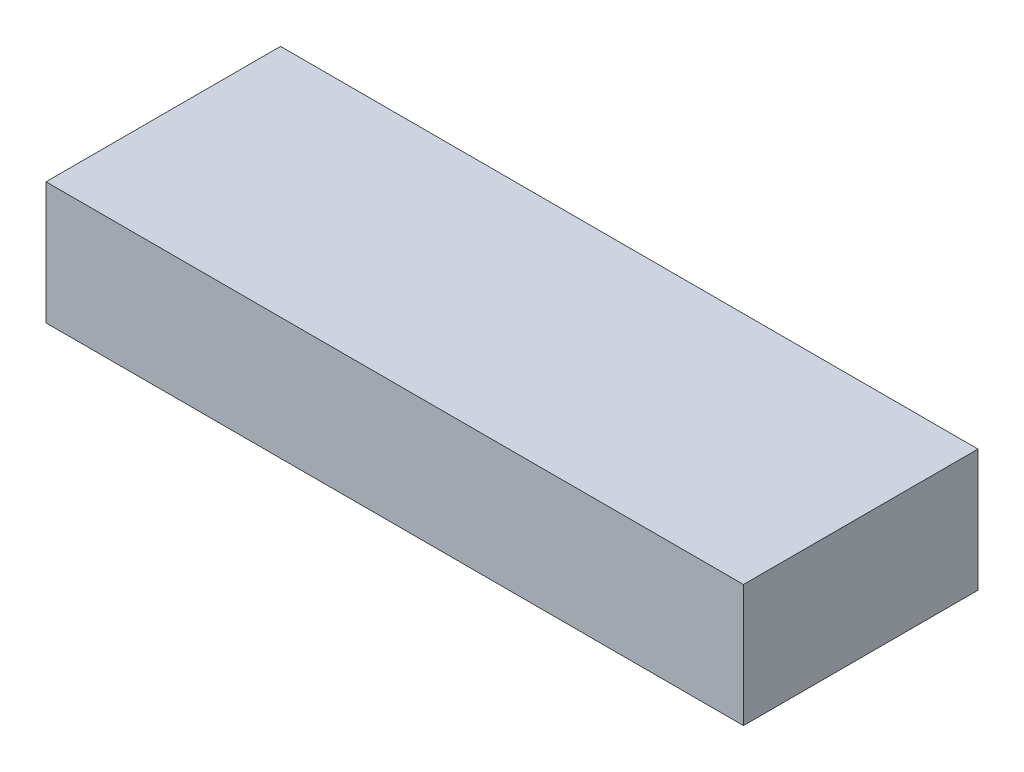
from build123d import *

# Parameters (mm, degrees)
SKETCH1_W           = 57.059703515
SKETCH1_H           = 19.18628263
BOSS_EXTRUDE1_DEPTH = 10


with BuildPart() as part:
    # Sketch1 → Boss-Extrude1 (new body)
    with BuildSketch(Plane(origin=(0, 0, 0), x_dir=(1, 0, 0), z_dir=(0, 1, 0))):
        with Locations((28.529851758, 9.593141315)):
            Rectangle(SKETCH1_W, SKETCH1_H)
    extrude(amount=BOSS_EXTRUDE1_DEPTH)


solid = part.part
